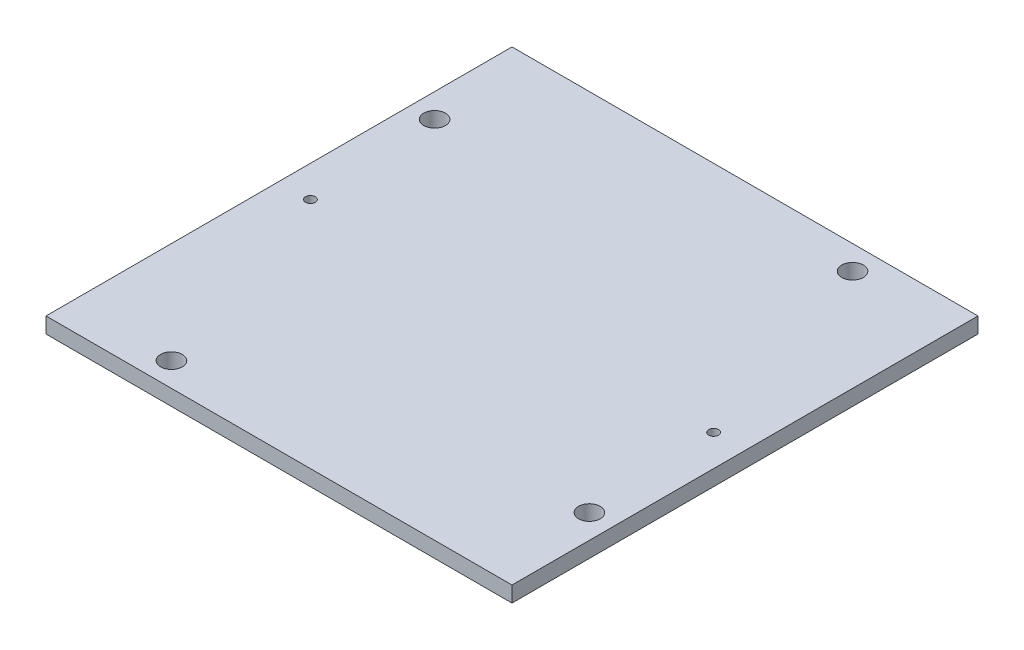
from build123d import *

# Parameters (mm, degrees)
SKETCH1_W           = 47.5488
SKETCH1_H           = 47.5488
BOSS_EXTRUDE1_DEPTH = 1.6002
SKETCH3_R           = 0.5
SKETCH3_R_2         = 1.1049
CUT_EXTRUDE1_DEPTH  = 1.6002


with BuildPart() as part:
    # Sketch1 → Boss-Extrude1 (new body)
    with BuildSketch(Plane(origin=(0, 0, 0), x_dir=(1, 0, 0), z_dir=(0, 1, 0))):
        Rectangle(SKETCH1_W, SKETCH1_H)
    extrude(amount=BOSS_EXTRUDE1_DEPTH)

    # Sketch3 → Cut-Extrude1 (cut)
    with BuildSketch(Plane(origin=(0, 1.6002, 0), x_dir=(1, 0, 0), z_dir=(0, 1, 0))):
        with Locations(Location((-20.574, 0, 0), (0, 0, 270))):
            Circle(SKETCH3_R)
        with Locations(Location((20.574, 0, 0), (0, 0, 270))):
            Circle(SKETCH3_R)
        with Locations(Location((21.3233, -13.4239, 0), (0, 0, 270))):
            Circle(SKETCH3_R_2)
        with Locations(Location((-13.4239, -21.3233, 0), (0, 0, 270))):
            Circle(SKETCH3_R_2)
        with Locations(Location((-21.3233, 13.4239, 0), (0, 0, 270))):
            Circle(SKETCH3_R_2)
        with Locations(Location((13.4239, 21.3233, 0), (0, 0, 270))):
            Circle(SKETCH3_R_2)
    extrude(amount=-CUT_EXTRUDE1_DEPTH, mode=Mode.SUBTRACT)


solid = part.part
